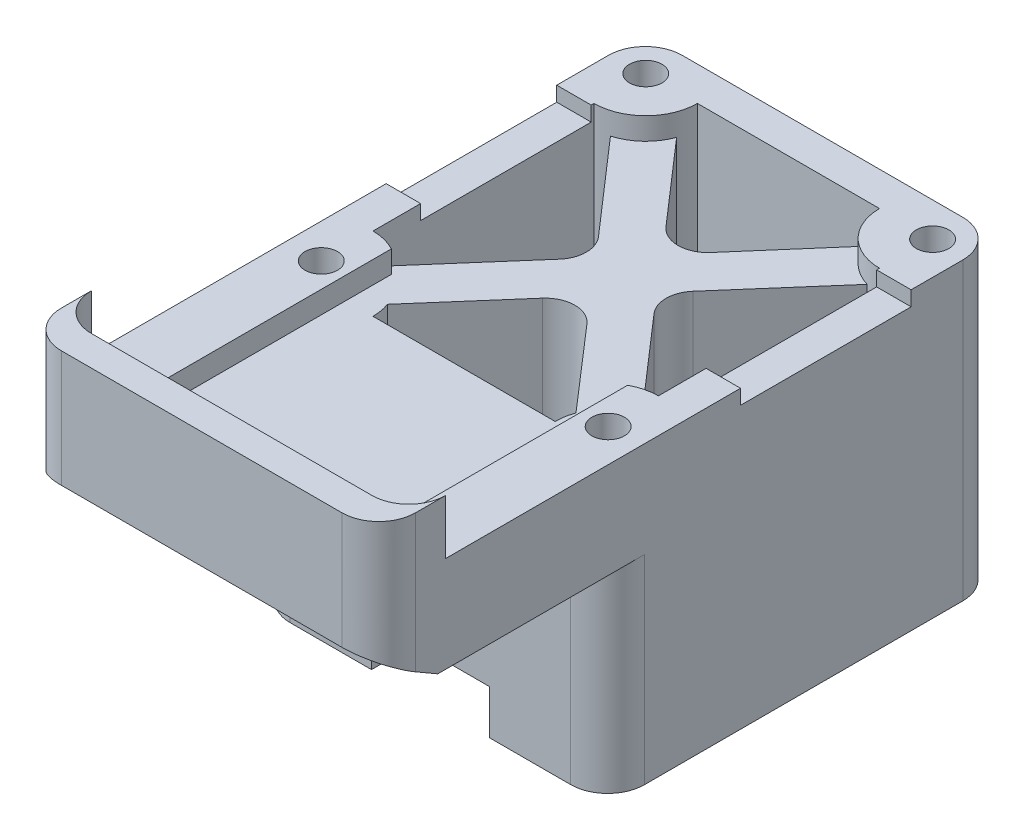
from build123d import *

# Parameters (mm, degrees)
EXTRUDE_1_DEPTH           = 20
EXTRUDE_2_DEPTH           = 18.5
EXTRUDE_START             = -6.5
EXTRUDE_8_DEPTH           = 6.5
CUT_EXTRUDE_1_DEPTH       = 3
CUT_EXTRUDE_12_REACH      = 37.343
SKETCH_8_W                = 8
SKETCH_8_H                = 3
SKETCH_1_10_R             = 1.1
CUT_EXTRUDE_13_DEPTH      = 38.032676918
SKETCH_18_W               = 11.552
SKETCH_18_H               = 1
CUT_EXTRUDE_16_DEPTH      = 43.464917168
CHAMFER_1_SIZE            = 4
CHAMFER_1_SIZE2           = 2.309401077
CUT_EXTRUDE_18_REACH      = 39.033
EXTRUDE_START_2           = 3.7
EXTRUDE_9_DEPTH           = 3.7
CUT_EXTRUDE_19_DEPTH      = 11.5
CUT_EXTRUDE_19_DEPTH_BACK = 15.742
SKETCH_22_W               = 16
SKETCH_22_H               = 1.5


with BuildPart() as part:
    # 草图1 → 凸台-拉伸1 (new body)
    with BuildSketch(Plane(origin=(0, 0, 0), x_dir=(1, 0, 0), z_dir=(0, 1, 0))):
        with BuildLine():
            Line((9.493752892, 13.289712364), (-9.506247108, 13.289712364))
            ThreePointArc((-9.506247108, 13.289712364), (-11.274014061, 12.557479317), (-12.006247108, 10.789712364))
            Line((-12.006247108, 10.789712364), (-12.006247108, -10.762287636))
            ThreePointArc((-12.006247108, -10.762287636), (-11.274014061, -12.530054589), (-9.506247108, -13.262287636))
            Line((-9.506247108, -13.262287636), (9.493752892, -13.262287636))
            ThreePointArc((9.493752892, -13.262287636), (11.261519845, -12.530054589), (11.993752892, -10.762287636))
            Line((11.993752892, -10.762287636), (11.993752892, 10.789712364))
            ThreePointArc((11.993752892, 10.789712364), (11.261519845, 12.557479317), (9.493752892, 13.289712364))
        make_face()
        with BuildLine():
            Line((-9.672300027, -7.488904962), (-9.672300027, 7.483095038))
            ThreePointArc((-9.672300027, 7.483095038), (-7.197426293, 8.508221304), (-6.172300027, 10.983095038))
            Line((-6.172300027, 10.983095038), (6.159805812, 10.983095038))
            ThreePointArc((6.159805812, 10.983095038), (7.184932077, 8.508221304), (9.659805812, 7.483095038))
            Line((9.659805812, 7.483095038), (9.659805812, -7.488904962))
            ThreePointArc((9.659805812, -7.488904962), (7.184932077, -8.514031228), (6.159805812, -10.988904962))
            Line((6.159805812, -10.988904962), (-6.172300027, -10.988904962))
            ThreePointArc((-6.172300027, -10.988904962), (-7.197426293, -8.514031228), (-9.672300027, -7.488904962))
        make_face(mode=Mode.SUBTRACT)
    extrude(amount=EXTRUDE_1_DEPTH)

    # 草图3<8> → 凸台-拉伸2 (add)
    with BuildSketch(Plane(origin=(0, 0, 0), x_dir=(1, 0, 0), z_dir=(0, 1, 0))):
        with BuildLine():
            Line((-1.499580884, 4.180163842), (-6.383603139, 9.785400263))
            ThreePointArc((-6.383603139, 9.785400263), (-7.282338381, 8.426127434), (-8.699129058, 7.621110763))
            Line((-8.699129058, 7.621110763), (-3.200900077, 1.310968891))
            ThreePointArc((-3.200900077, 1.310968891), (-2.708791154, -0.002904962), (-3.200900077, -1.316778815))
            Line((-3.200900077, -1.316778815), (-8.699129058, -7.626920687))
            ThreePointArc((-8.699129058, -7.626920687), (-7.282338381, -8.431937358), (-6.383603139, -9.791210187))
            Line((-6.383603139, -9.791210187), (-1.499580884, -4.185973766))
            ThreePointArc((-1.499580884, -4.185973766), (0.01074875, -3.499849106), (1.51940074, -4.189654748))
            Line((1.51940074, -4.189654748), (6.372627583, -9.78704836))
            ThreePointArc((6.372627583, -9.78704836), (7.271462931, -8.43042528), (8.686634842, -7.626920687))
            Line((8.686634842, -7.626920687), (3.188405862, -1.316778815))
            ThreePointArc((3.188405862, -1.316778815), (2.696296938, -0.002904962), (3.188405862, 1.310968891))
            Line((3.188405862, 1.310968891), (8.686634842, 7.621110763))
            ThreePointArc((8.686634842, 7.621110763), (7.271462931, 8.424615355), (6.372627583, 9.781238436))
            Line((6.372627583, 9.781238436), (1.51940074, 4.183844824))
            ThreePointArc((1.51940074, 4.183844824), (0.01074875, 3.494039181), (-1.499580884, 4.180163842))
        make_face()
    extrude(amount=EXTRUDE_2_DEPTH)

    # 草图10 → 凸台-拉伸8 (add)
    with BuildSketch(Plane(origin=(0, 20, 0), x_dir=(1, 0, 0), z_dir=(0, 1, 0)).offset(EXTRUDE_START)):
        with BuildLine():
            Line((-12.006247108, -10.762287636), (-12.006247108, -28.762287636))
            Line((-12.006247108, -28.762287636), (11.993752892, -28.762287636))
            Line((11.993752892, -28.762287636), (11.993752892, -10.762287636))
            ThreePointArc((11.993752892, -10.762287636), (11.261519845, -12.530054589), (9.493752892, -13.262287636))
            Line((9.493752892, -13.262287636), (-9.506247108, -13.262287636))
            ThreePointArc((-9.506247108, -13.262287636), (-11.274014061, -12.530054589), (-12.006247108, -10.762287636))
        make_face()
    extrude(amount=EXTRUDE_8_DEPTH)

    # 草图3<6> → 切除-拉伸1 (cut)
    with BuildSketch(Plane(origin=(0, 0, 0), x_dir=(1, 0, 0), z_dir=(0, 1, 0))):
        with BuildLine():
            Line((-1.499580884, 4.180163842), (-6.383603139, 9.785400263))
            ThreePointArc((-6.383603139, 9.785400263), (-7.282338381, 8.426127434), (-8.699129058, 7.621110763))
            Line((-8.699129058, 7.621110763), (-3.200900077, 1.310968891))
            ThreePointArc((-3.200900077, 1.310968891), (-2.708791154, -0.002904962), (-3.200900077, -1.316778815))
            Line((-3.200900077, -1.316778815), (-8.699129058, -7.626920687))
            ThreePointArc((-8.699129058, -7.626920687), (-7.282338381, -8.431937358), (-6.383603139, -9.791210187))
            Line((-6.383603139, -9.791210187), (-1.499580884, -4.185973766))
            ThreePointArc((-1.499580884, -4.185973766), (0.01074875, -3.499849106), (1.51940074, -4.189654748))
            Line((1.51940074, -4.189654748), (6.372627583, -9.78704836))
            ThreePointArc((6.372627583, -9.78704836), (7.271462931, -8.43042528), (8.686634842, -7.626920687))
            Line((8.686634842, -7.626920687), (3.188405862, -1.316778815))
            ThreePointArc((3.188405862, -1.316778815), (2.696296938, -0.002904962), (3.188405862, 1.310968891))
            Line((3.188405862, 1.310968891), (8.686634842, 7.621110763))
            ThreePointArc((8.686634842, 7.621110763), (7.271462931, 8.424615355), (6.372627583, 9.781238436))
            Line((6.372627583, 9.781238436), (1.51940074, 4.183844824))
            ThreePointArc((1.51940074, 4.183844824), (0.01074875, 3.494039181), (-1.499580884, 4.180163842))
        make_face()
    extrude(amount=CUT_EXTRUDE_1_DEPTH, mode=Mode.SUBTRACT)

    # 草图8 → 切除-拉伸12 (cut, up to next)
    with BuildSketch(Plane.XY.offset(13.262287636), mode=Mode.PRIVATE) as cut_extrude_12_sk1:
        with Locations((0, 1.5)):
            Rectangle(SKETCH_8_W, SKETCH_8_H)
    cut_extrude_12_tool1 = extrude(cut_extrude_12_sk1.sketch, amount=-CUT_EXTRUDE_12_REACH, mode=Mode.PRIVATE) & part.part
    add(cut_extrude_12_tool1.solids().sort_by_distance((0, 1.5, 13.262288))[0], mode=Mode.SUBTRACT)

    # 草图1<10> → 切除-拉伸13 (cut, through all)
    with BuildSketch(Plane(origin=(0, 0, 0), x_dir=(1, 0, 0), z_dir=(0, 1, 0))):
        with Locations(Location((-9.672300027, 10.983095038, 0), (0, 0, 270))):
            Circle(SKETCH_1_10_R)
        with Locations(Location((9.755699973, 10.983095038, 0), (0, 0, 90))):
            Circle(SKETCH_1_10_R)
        with Locations(Location((-9.672300027, -10.988904962, 0), (0, 0, 90))):
            Circle(SKETCH_1_10_R)
        with Locations(Location((9.755699973, -10.988904962, 0), (0, 0, 270))):
            Circle(SKETCH_1_10_R)
    extrude(amount=CUT_EXTRUDE_13_DEPTH, mode=Mode.SUBTRACT)

    # 草图18 → 切除-拉伸16 (cut, through all)
    with BuildSketch(Plane(origin=(11.993752892, 0, 0), x_dir=(0, 0, -1), z_dir=(1, 0, 0))):
        with Locations((1.513712364, 19.5)):
            Rectangle(SKETCH_18_W, SKETCH_18_H)
    extrude(amount=-CUT_EXTRUDE_16_DEPTH, mode=Mode.SUBTRACT)

    # 倒角1
    chamfer_1_edges = [part.edges().sort_by_distance(p)[0] for p in [
        (-0.006247108, 13.5, 28.762287636),
    ]]
    chamfer_1_side = [part.faces().sort_by_distance(p)[0] for p in [
        (-0.006247108, 13.5, 20.952803872),
    ]]
    chamfer(chamfer_1_edges, length=CHAMFER_1_SIZE, length2=CHAMFER_1_SIZE2, reference=chamfer_1_side[0])

    # 切除-拉伸18: up to this plane
    cut_extrude_18_end = Plane(origin=(0, 15.809401077, 28.762287636), z_dir=(0, -0.8660254037844402, 0.49999999999999745))
    # 草图20 → 切除-拉伸18 (cut, up to the surface)
    with BuildSketch(Plane(origin=(0, 20, 0), x_dir=(1, 0, 0), z_dir=(0, 1, 0)), mode=Mode.PRIVATE) as cut_extrude_18_sk1:
        with BuildLine():
            Line((-12.006247108, -26.262287636), (-12.006247108, -28.762287636))
            Line((-12.006247108, -28.762287636), (-9.506247108, -28.762287636))
            ThreePointArc((-9.506247108, -28.762287636), (-11.274014061, -28.030054589), (-12.006247108, -26.262287636))
        make_face()
    cut_extrude_18_tool1 = split(extrude(cut_extrude_18_sk1.sketch, amount=-CUT_EXTRUDE_18_REACH, mode=Mode.PRIVATE), bisect_by=cut_extrude_18_end, keep=Keep.BOTH, mode=Mode.PRIVATE)
    add(cut_extrude_18_tool1.solids().sort_by_distance((-11.447827, 20, 28.203868))[0], mode=Mode.SUBTRACT)
    # 草图20 → 切除-拉伸18 (cut, up to the surface)
    with BuildSketch(Plane(origin=(0, 20, 0), x_dir=(1, 0, 0), z_dir=(0, 1, 0)), mode=Mode.PRIVATE) as cut_extrude_18_sk2:
        with BuildLine():
            Line((11.993752892, -26.262287636), (11.993752892, -28.762287636))
            Line((11.993752892, -28.762287636), (9.493752892, -28.762287636))
            ThreePointArc((9.493752892, -28.762287636), (11.261519845, -28.030054589), (11.993752892, -26.262287636))
        make_face()
    cut_extrude_18_tool2 = split(extrude(cut_extrude_18_sk2.sketch, amount=-CUT_EXTRUDE_18_REACH, mode=Mode.PRIVATE), bisect_by=cut_extrude_18_end, keep=Keep.BOTH, mode=Mode.PRIVATE)
    add(cut_extrude_18_tool2.solids().sort_by_distance((11.435333, 20, 28.203868))[0], mode=Mode.SUBTRACT)

    # 草图21 → 凸台-拉伸9 (add)
    with BuildSketch(Plane(origin=(0, 20, 0), x_dir=(1, 0, 0), z_dir=(0, 1, 0)).offset(EXTRUDE_START_2)):
        with BuildLine():
            ThreePointArc((-9.506247108, -26.730904962), (-11.274014061, -25.998671915), (-12.006247108, -24.230904962))
            Line((-12.006247108, -24.230904962), (-12.006247108, -26.262287636))
            ThreePointArc((-12.006247108, -26.262287636), (-11.274014061, -28.030054589), (-9.506247108, -28.762287636))
            Line((-9.506247108, -28.762287636), (9.493752892, -28.762287636))
            ThreePointArc((9.493752892, -28.762287636), (11.261519845, -28.030054589), (11.993752892, -26.262287636))
            Line((11.993752892, -26.262287636), (11.993752892, -24.230904962))
            ThreePointArc((11.993752892, -24.230904962), (11.261519845, -25.998671915), (9.493752892, -26.730904962))
            Line((9.493752892, -26.730904962), (-9.506247108, -26.730904962))
        make_face()
    extrude(amount=-EXTRUDE_9_DEPTH)

    # 草图22 → 切除-拉伸19 (cut, two sides: drawn at the far end of the back side and taken through both)
    with BuildSketch(Plane(origin=(0, 0, 10.988904962), x_dir=(-1, 0, 0), z_dir=(0, 0, -1)).offset(-CUT_EXTRUDE_19_DEPTH_BACK)):
        with Locations((0.006247108, 19.25)):
            Rectangle(SKETCH_22_W, SKETCH_22_H)
    extrude(amount=CUT_EXTRUDE_19_DEPTH + CUT_EXTRUDE_19_DEPTH_BACK, mode=Mode.SUBTRACT)


solid = part.part
